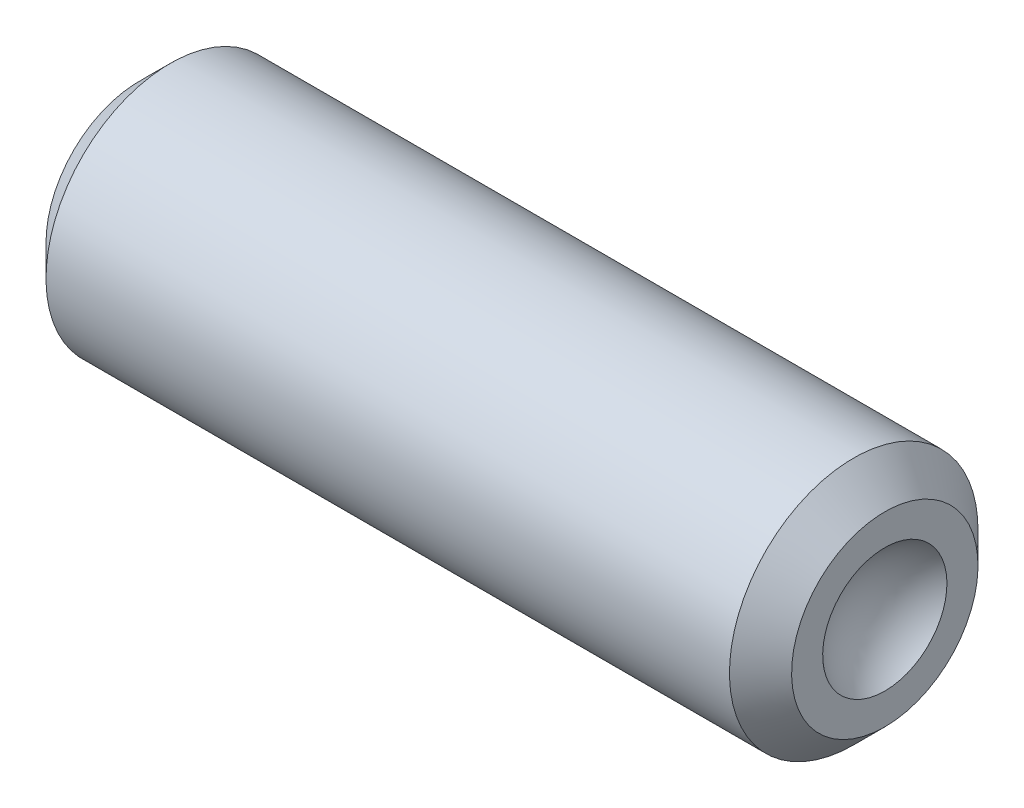
from build123d import *

# Parameters (mm, degrees)
CUT_EXTRUDE1_DEPTH = 10


with BuildPart() as part:
    # Sketch1 → Revolve1 (revolve)
    with BuildSketch(Plane.XY, mode=Mode.PRIVATE) as revolve1_sk:
        with BuildLine():
            Line((0, 0), (0, 1.5))
            Line((0, 1.5), (0.5, 2))
            Line((0.5, 2), (11.5, 2))
            Line((11.5, 2), (12, 1.5))
            Line((12, 1.5), (12, 1))
            ThreePointArc((12, 1), (11.631966011, 0.559016994), (11.5, 0))
            Line((11.5, 0), (0, 0))
        make_face()
    revolve(revolve1_sk.sketch.rotate(Axis((0, 0, 0), (1, 0, 0)), 180), axis=Axis((0, 0, 0), (1, 0, 0)))

    # Sketch2 → Cut-Extrude1 (cut)
    with BuildSketch(Plane.ZY):
        Polygon((0, 1.154700538), (-1, 0.577350269), (-1, -0.577350269), (0, -1.154700538), (1, -0.577350269), (1, 0.577350269), align=None)
    extrude(amount=-CUT_EXTRUDE1_DEPTH, mode=Mode.SUBTRACT)


solid = part.part
